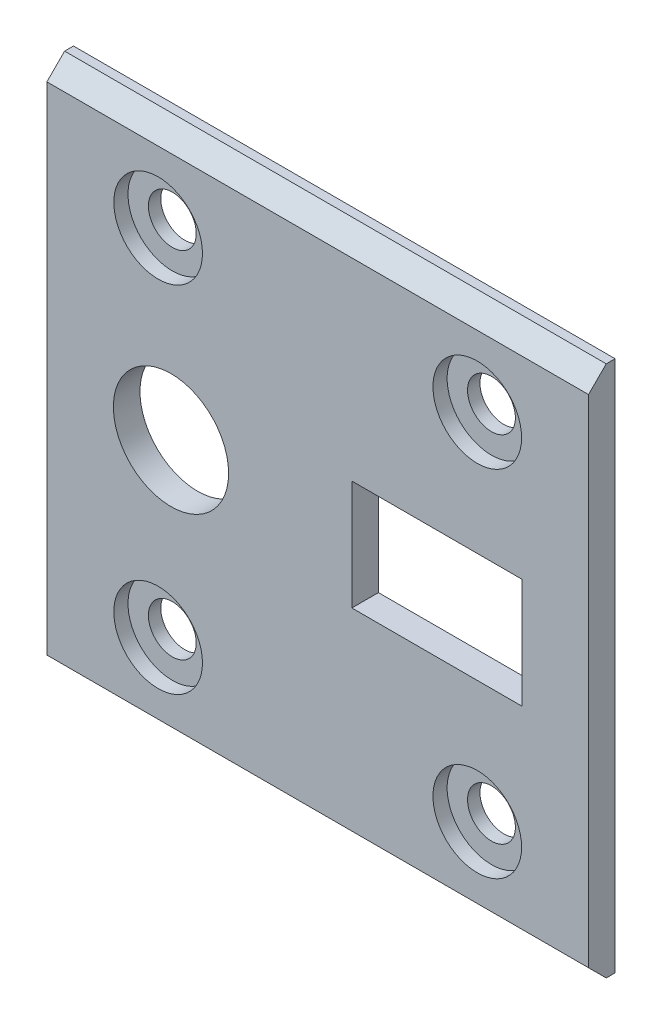
from build123d import *

# Parameters (mm, degrees)
SCHIZZO1_W                   = 61.1
SCHIZZO1_H                   = 20
SCHIZZO1_R                   = 6.5
SCHIZZO1_W_2                 = 19.2
SCHIZZO1_H_2                 = 12.4
ESTRUSIONE_ESTRUSIONE1_DEPTH = 3
SCHIZZO5_W                   = 61.1
SCHIZZO5_H                   = 20
ESTRUSIONE_ESTRUSIONE2_DEPTH = 3
SCHIZZO6_R                   = 2.7
TAGLIO_ESTRUSIONE1_DEPTH     = 3
SCHIZZO7_R                   = 5
TAGLIO_ESTRUSIONE2_DEPTH     = 1.6
SMUSSO1_SIZE                 = 2


with BuildPart() as part:
    # Schizzo1 → Estrusione-Estrusione1 (new body)
    with BuildSketch(Plane.XY):
        Rectangle(SCHIZZO1_W, SCHIZZO1_H)
        with Locations((-16.55, 0)):
            Circle(SCHIZZO1_R, mode=Mode.SUBTRACT)
        with Locations((13.45, 0)):
            Rectangle(SCHIZZO1_W_2, SCHIZZO1_H_2, mode=Mode.SUBTRACT)
    extrude(amount=ESTRUSIONE_ESTRUSIONE1_DEPTH)

    # Schizzo5 → Estrusione-Estrusione2 (add)
    with BuildSketch(Plane.XY.offset(3)):
        with Locations((0, 20)):
            Rectangle(SCHIZZO5_W, SCHIZZO5_H)
    estrusione_estrusione2 = extrude(amount=-ESTRUSIONE_ESTRUSIONE2_DEPTH)

    # Schizzo6 → Taglio-Estrusione1 (cut)
    with BuildSketch(Plane.XY.offset(3)):
        with Locations((-18, 20)):
            Circle(SCHIZZO6_R)
        with Locations((18, 20)):
            Circle(SCHIZZO6_R)
    taglio_estrusione1 = extrude(amount=-TAGLIO_ESTRUSIONE1_DEPTH, mode=Mode.SUBTRACT)

    # Schizzo7 → Taglio-Estrusione2 (cut)
    with BuildSketch(Plane.XY.offset(3)):
        with Locations((-18, 20)):
            Circle(SCHIZZO7_R)
        with Locations((18, 20)):
            Circle(SCHIZZO7_R)
    taglio_estrusione2 = extrude(amount=-TAGLIO_ESTRUSIONE2_DEPTH, mode=Mode.SUBTRACT)

    # Specchia2: Estrusione-Estrusione2, Taglio-Estrusione1, Taglio-Estrusione2 across plane
    add(estrusione_estrusione2.mirror(Plane.ZX))
    add(taglio_estrusione1.mirror(Plane.ZX), mode=Mode.SUBTRACT)
    add(taglio_estrusione2.mirror(Plane.ZX), mode=Mode.SUBTRACT)

    # Smusso1
    smusso1_edges = [part.edges().sort_by_distance(p)[0] for p in [
        (0, 30, 3),
        (0, -30, 3),
    ]]
    chamfer(smusso1_edges, length=SMUSSO1_SIZE)


solid = part.part
